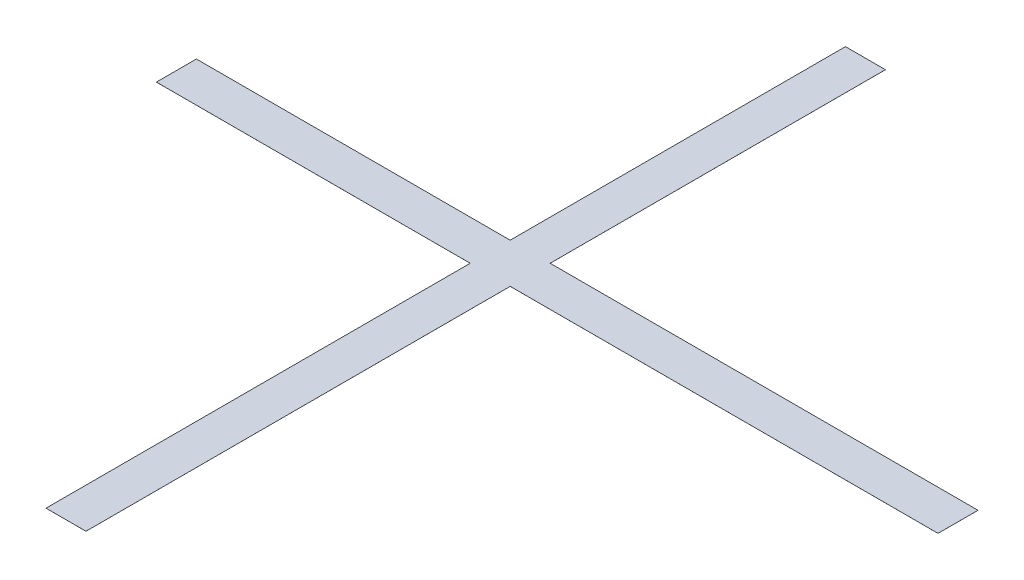
from build123d import *

# Parameters (mm, degrees)
RESSALTO_EXTRUS_O19_DEPTH = 0.01


with BuildPart() as part:
    # Esboço1 → Ressalto-extrusão19 (new body)
    with BuildSketch(Plane(origin=(0, 0, 0), x_dir=(1, 0, 0), z_dir=(0, 1, 0))):
        Polygon((404.050223407, 922.489020101), (424.050223407, 922.489020101), (424.050223407, 754.742667039), (638.115813284, 754.742667039), (638.115813284, 734.742667039), (424.050223407, 734.742667039), (424.050223407, 522.489020101), (404.050223407, 522.489020101), (404.050223407, 734.742667039), (247.039930484, 734.742667039), (247.039930484, 754.742667039), (404.050223407, 754.742667039), align=None)
    extrude(amount=RESSALTO_EXTRUS_O19_DEPTH)


solid = part.part
